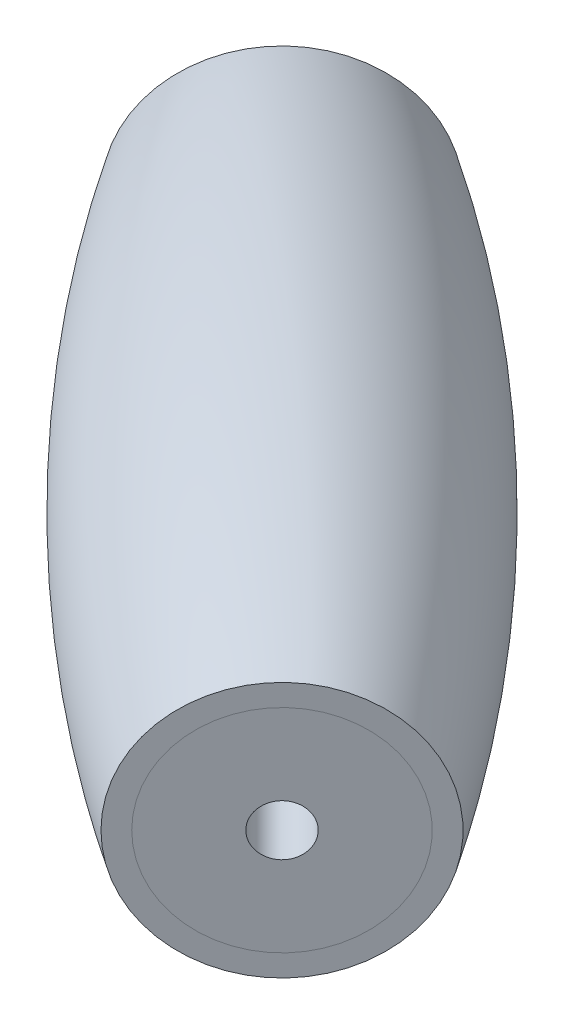
from build123d import *

# Parameters (mm, degrees)
SKETCH3_R          = 0.6
CUT_EXTRUDE1_DEPTH = 33.10933343


with BuildPart() as part:
    # Sketch2 → Revolve1 (revolve)
    with BuildSketch(Plane(origin=(0, 0, 0), x_dir=(0, -1, 0), z_dir=(-0.7071067811865488, 0, 0.7071067811865464)), mode=Mode.PRIVATE) as revolve1_sk:
        with BuildLine():
            Line((-21.104245277, -9.132281611), (-21.104245277, 9.132281611))
            Line((-21.104245277, 9.132281611), (-23.594423262, 9.132281611))
            ThreePointArc((-23.594423262, 9.132281611), (-24.5, 0), (-23.594423262, -9.132281611))
            Line((-23.594423262, -9.132281611), (-21.104245277, -9.132281611))
        make_face()
    revolve(revolve1_sk.sketch.rotate(Axis((-6.457498255, 21.104245277, -6.457498255), (0.7071067811865464, 0, 0.7071067811865488)), 90), axis=Axis((-6.457498255, 21.104245277, -6.457498255), (0.7071067811865464, 0, 0.7071067811865488)))

    # Sketch3 → Cut-Extrude1 (cut, through all)
    with BuildSketch(Plane(origin=(6.457498255, 0, 6.457498255), x_dir=(0.7071067811865488, 0, -0.7071067811865462), z_dir=(0.7071067811865462, 0, 0.7071067811865488))):
        with Locations((0, 21.104245277)):
            Circle(SKETCH3_R)
    extrude(amount=-CUT_EXTRUDE1_DEPTH, mode=Mode.SUBTRACT)


with BuildPart() as body_2:
    # Sketch4 → Revolve4 (revolve)
    with BuildSketch(Plane(origin=(0, 0, 0), x_dir=(0.7071067811865464, 0, 0.7071067811865488), z_dir=(-0.7071067811865488, 0, 0.7071067811865464)), mode=Mode.PRIVATE) as revolve4_sk:
        with BuildLine():
            Line((-9.132281611, 24.104245277), (-9.132281611, 23.594423262))
            ThreePointArc((-9.132281611, 23.594423262), (0, 24.5), (9.132281611, 23.594423262))
            Line((9.132281611, 23.594423262), (9.132281611, 24.104245277))
            ThreePointArc((9.132281611, 24.104245277), (0, 25), (-9.132281611, 24.104245277))
        make_face()
    revolve(revolve4_sk.sketch.rotate(Axis((-6.457498255, 21.104245277, -6.457498255), (0.7071067811865464, 0, 0.7071067811865488)), 90), axis=Axis((-6.457498255, 21.104245277, -6.457498255), (0.7071067811865464, 0, 0.7071067811865488)))


solid = Compound([part.part, body_2.part])
